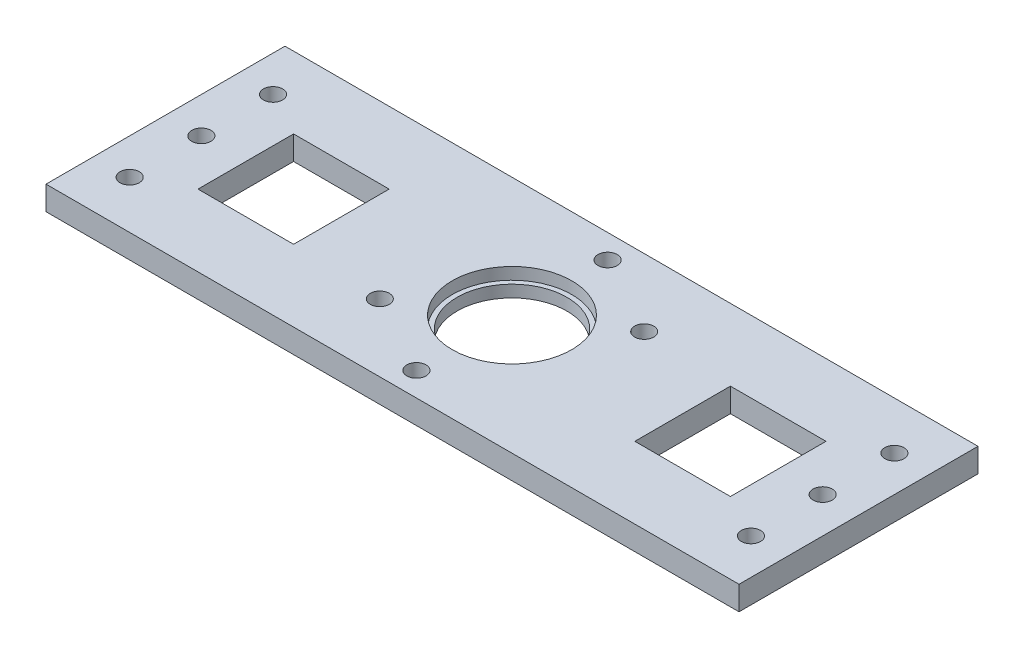
from build123d import *

# Parameters (mm, degrees)
SKETCH1_W                  = 184.15
SKETCH1_H                  = 63.5
BOSS_EXTRUDE1_DEPTH        = 6.35
SKETCH3_R                  = 14.605
CUT_EXTRUDE1_DEPTH         = 98.602206046
F_10_CLEARANCE_HOLE1_D     = 5.1054
F_6_5_6_5_DIAMETER_HOLE3_D = 6.5
SKETCH29_R                 = 15.875
CUT_EXTRUDE5_DEPTH         = 3.175
F_10_CLEARANCE_HOLE2_D     = 5.1054
SKETCH36_R                 = 2.54
CUT_EXTRUDE6_DEPTH         = 98.602206046
SKETCH37_W                 = 25.4
SKETCH37_H                 = 25.4
CUT_EXTRUDE7_DEPTH         = 98.602206046
SKETCH38_W                 = 25.4
SKETCH38_H                 = 25.4
CUT_EXTRUDE8_DEPTH         = 98.602206046


with BuildPart() as part:
    # Sketch1 → Boss-Extrude1 (new body)
    with BuildSketch(Plane(origin=(0, 0, 0), x_dir=(1, 0, 0), z_dir=(0, 1, 0))):
        Rectangle(SKETCH1_W, SKETCH1_H)
    extrude(amount=BOSS_EXTRUDE1_DEPTH)

    # Sketch3 → Cut-Extrude1 (cut, through all)
    with BuildSketch(Plane(origin=(0, 6.35, 0), x_dir=(1, 0, 0), z_dir=(0, 1, 0))):
        with Locations(Location((0, 0, 0), (0, 0, 270))):
            Circle(SKETCH3_R)
    extrude(amount=-CUT_EXTRUDE1_DEPTH, mode=Mode.SUBTRACT)

    # #10 Clearance Hole1 (through all)
    with Locations(Plane(origin=(0, 0, 0), x_dir=(-1, 0, 0), z_dir=(0, -1, 0))):
        with Locations((0, -25.4), (0, 25.4)):
            Hole(F_10_CLEARANCE_HOLE1_D / 2)

    # Ø6.5 (6.5) Diameter Hole3 (through all)
    with Locations(Plane(origin=(0, 0, 0), x_dir=(-1, 0, 0), z_dir=(0, -1, 0))):
        with Locations((58.039, 0), (-58.039, 0)):
            Hole(F_6_5_6_5_DIAMETER_HOLE3_D / 2)

    # Sketch29 → Cut-Extrude5 (cut)
    with BuildSketch(Plane(origin=(0, 6.35, 0), x_dir=(1, 0, 0), z_dir=(0, 1, 0))):
        with Locations(Location((0, 0, 0), (0, 0, 270))):
            Circle(SKETCH29_R)
    extrude(amount=-CUT_EXTRUDE5_DEPTH, mode=Mode.SUBTRACT)

    # #10 Clearance Hole2 (through all)
    with Locations(Plane(origin=(0, 6.35, 0), x_dir=(1, 0, 0), z_dir=(0, 1, 0))):
        with Locations((-82.55, 19.05), (-82.55, -19.05), (82.55, -19.05), (82.55, 19.05), (-82.55, 0), (82.55, 0)):
            Hole(F_10_CLEARANCE_HOLE2_D / 2)

    # Sketch36 → Cut-Extrude6 (cut, through all)
    with BuildSketch(Plane.XZ):
        with Locations(Location((-21.329210467, 13.7922, 0), (0, 0, 270))):
            Circle(SKETCH36_R)
        with Locations(Location((21.329210467, -13.7922, 0), (0, 0, 270))):
            Circle(SKETCH36_R)
    extrude(amount=-CUT_EXTRUDE6_DEPTH, mode=Mode.SUBTRACT)

    # Sketch37 → Cut-Extrude7 (cut, through all)
    with BuildSketch(Plane(origin=(0, 6.35, 0), x_dir=(1, 0, 0), z_dir=(0, 1, 0))):
        with Locations((-58.039, 0)):
            Rectangle(SKETCH37_W, SKETCH37_H)
    extrude(amount=-CUT_EXTRUDE7_DEPTH, mode=Mode.SUBTRACT)

    # Sketch38 → Cut-Extrude8 (cut, through all)
    with BuildSketch(Plane(origin=(0, 6.35, 0), x_dir=(1, 0, 0), z_dir=(0, 1, 0))):
        with Locations((58.039, 0)):
            Rectangle(SKETCH38_W, SKETCH38_H)
    extrude(amount=-CUT_EXTRUDE8_DEPTH, mode=Mode.SUBTRACT)


solid = part.part
